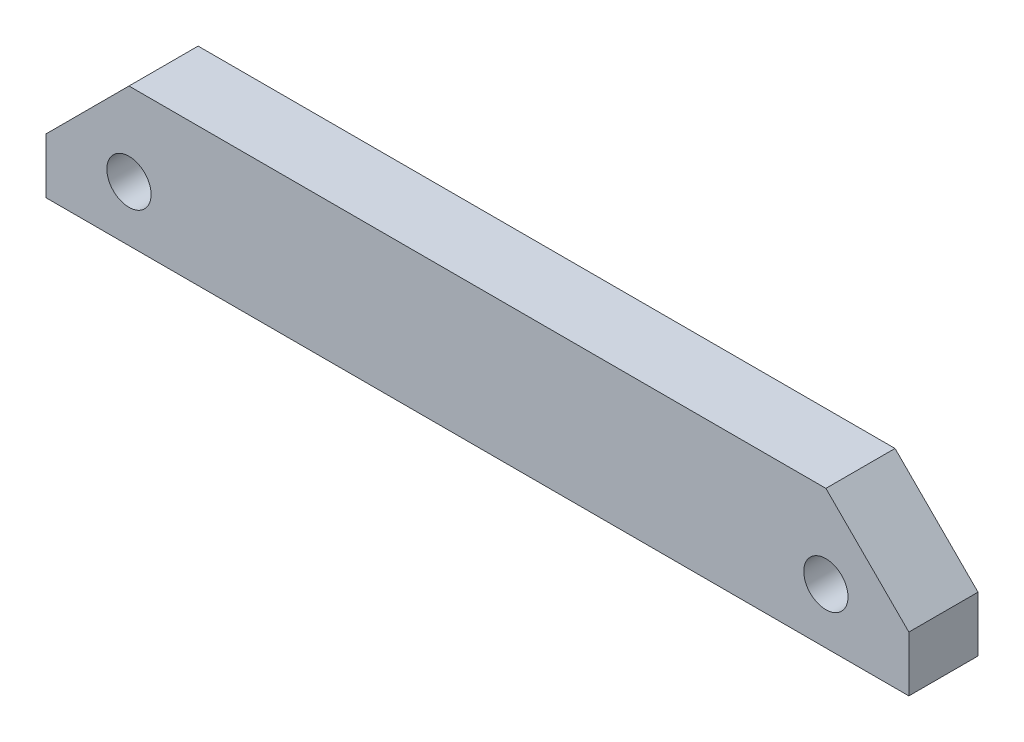
from build123d import *

# Parameters (mm, degrees)
DODANIE_WYCI_GNI_CIE1_DEPTH = 5
SZKIC2_R                    = 1.6
WYTNIJ_WYCI_GNI_CIE1_DEPTH  = 34.142721675


with BuildPart() as part:
    # Szkic1 → Dodanie-wyciągnięcie1 (new body)
    with BuildSketch(Plane.XY):
        Polygon((-31.2, 0), (31.2, 0), (31.2, 4), (25.2, 10), (-25.2, 10), (-31.2, 4), align=None)
    extrude(amount=DODANIE_WYCI_GNI_CIE1_DEPTH)

    # Szkic2 → Wytnij-wyciągnięcie1 (cut, through all)
    with BuildSketch(Plane.XY.offset(5)):
        with Locations((-25.2, 4)):
            Circle(SZKIC2_R)
        with Locations(Location((25.2, 4, 0), (0, 0, 180))):
            Circle(SZKIC2_R)
    extrude(amount=-WYTNIJ_WYCI_GNI_CIE1_DEPTH, mode=Mode.SUBTRACT)


solid = part.part
